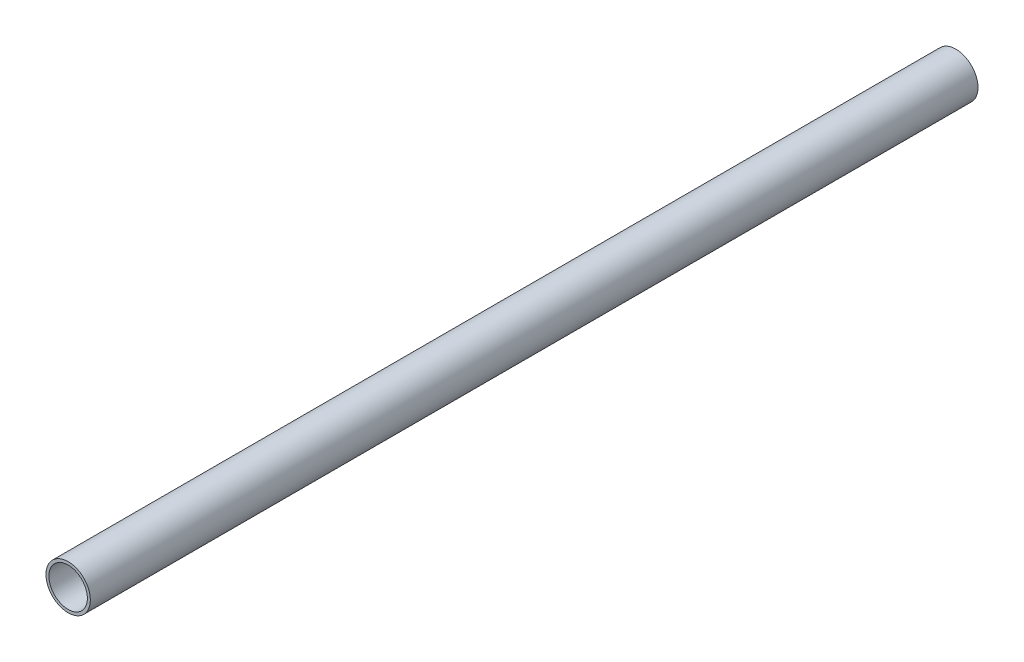
from build123d import *

# Parameters (mm, degrees)
SKETCH1_R           = 15
SKETCH1_R_2         = 13
BOSS_EXTRUDE1_DEPTH = 600


with BuildPart() as part:
    # Sketch1 → Boss-Extrude1 (new body)
    with BuildSketch(Plane.XY):
        Circle(SKETCH1_R)
        Circle(SKETCH1_R_2, mode=Mode.SUBTRACT)
    extrude(amount=BOSS_EXTRUDE1_DEPTH)


solid = part.part
